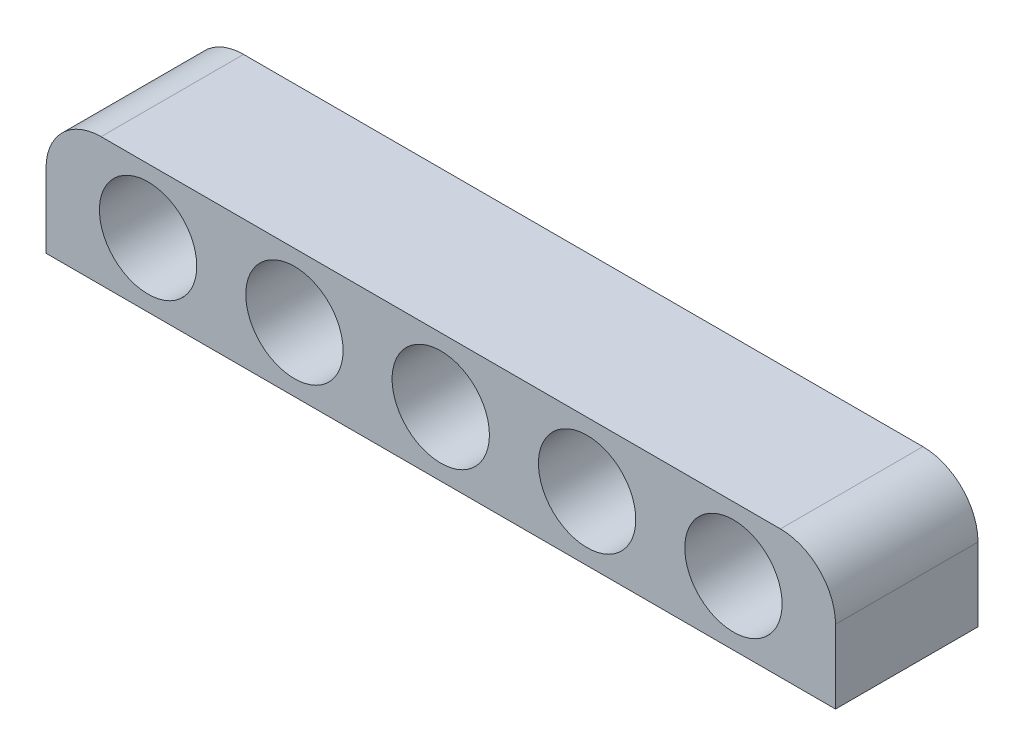
from build123d import *

# Parameters (mm, degrees)
SKETCH1_W           = 30
SKETCH1_H           = 6
BOSS_EXTRUDE1_DEPTH = 7.76
SKETCH2_R           = 2.65
CUT_EXTRUDE1_DEPTH  = 8
SKETCH3_W           = 7.76
SKETCH3_H           = 6
BOSS_EXTRUDE2_DEPTH = 6
SKETCH4_W           = 7.76
SKETCH4_H           = 6
BOSS_EXTRUDE3_DEPTH = 6
SKETCH5_R           = 2.65
CUT_EXTRUDE2_DEPTH  = 8
SKETCH6_W           = 42
SKETCH6_H           = 7.76
BOSS_EXTRUDE4_DEPTH = 0.5
SKETCH7_W           = 7.76
SKETCH7_H           = 6.5
BOSS_EXTRUDE5_DEPTH = 0.5
SKETCH8_W           = 42.5
SKETCH8_H           = 7.76
BOSS_EXTRUDE6_DEPTH = 0.5
SKETCH9_W           = 7.76
SKETCH9_H           = 7
BOSS_EXTRUDE7_DEPTH = 0.5
FILLET1_R           = 3


with BuildPart() as part:
    # Sketch1 → Boss-Extrude1 (new body)
    with BuildSketch(Plane.XY):
        Rectangle(SKETCH1_W, SKETCH1_H)
    extrude(amount=BOSS_EXTRUDE1_DEPTH)

    # Sketch2 → Cut-Extrude1 (cut)
    with BuildSketch(Plane.XY.offset(7.76)):
        Circle(SKETCH2_R)
        with Locations((7.97, 0)):
            Circle(SKETCH2_R)
        with Locations((-7.97, 0)):
            Circle(SKETCH2_R)
    extrude(amount=-CUT_EXTRUDE1_DEPTH, mode=Mode.SUBTRACT)

    # Sketch3 → Boss-Extrude2 (add)
    with BuildSketch(Plane.ZY.offset(15)):
        with Locations((3.88, 0)):
            Rectangle(SKETCH3_W, SKETCH3_H)
    extrude(amount=BOSS_EXTRUDE2_DEPTH)

    # Sketch4 → Boss-Extrude3 (add)
    with BuildSketch(Plane(origin=(15, 0, 0), x_dir=(0, 0, -1), z_dir=(1, 0, 0))):
        with Locations((-3.88, 0)):
            Rectangle(SKETCH4_W, SKETCH4_H)
    extrude(amount=BOSS_EXTRUDE3_DEPTH)

    # Sketch5 → Cut-Extrude2 (cut)
    with BuildSketch(Plane.XY.offset(7.76)):
        with Locations((-15.94, 0)):
            Circle(SKETCH5_R)
        with Locations((15.94, 0)):
            Circle(SKETCH5_R)
    extrude(amount=-CUT_EXTRUDE2_DEPTH, mode=Mode.SUBTRACT)

    # Sketch6 → Boss-Extrude4 (add)
    with BuildSketch(Plane(origin=(0, 3, 0), x_dir=(1, 0, 0), z_dir=(0, 1, 0))):
        with Locations((0, -3.88)):
            Rectangle(SKETCH6_W, SKETCH6_H)
    extrude(amount=BOSS_EXTRUDE4_DEPTH)

    # Sketch7 → Boss-Extrude5 (add)
    with BuildSketch(Plane(origin=(21, 0, 0), x_dir=(0, 0, -1), z_dir=(1, 0, 0))):
        with Locations((-3.88, 0.25)):
            Rectangle(SKETCH7_W, SKETCH7_H)
    extrude(amount=BOSS_EXTRUDE5_DEPTH)

    # Sketch8 → Boss-Extrude6 (add)
    with BuildSketch(Plane.XZ.offset(3)):
        with Locations((0.25, 3.88)):
            Rectangle(SKETCH8_W, SKETCH8_H)
    extrude(amount=BOSS_EXTRUDE6_DEPTH)

    # Sketch9 → Boss-Extrude7 (add)
    with BuildSketch(Plane.ZY.offset(21)):
        with Locations((3.88, 0)):
            Rectangle(SKETCH9_W, SKETCH9_H)
    extrude(amount=BOSS_EXTRUDE7_DEPTH)

    # Fillet1
    fillet1_edges = [part.edges().sort_by_distance(p)[0] for p in [
        (-21.5, 3.5, 3.88),
        (21.5, 3.5, 3.88),
    ]]
    fillet(fillet1_edges, radius=FILLET1_R)


solid = part.part
